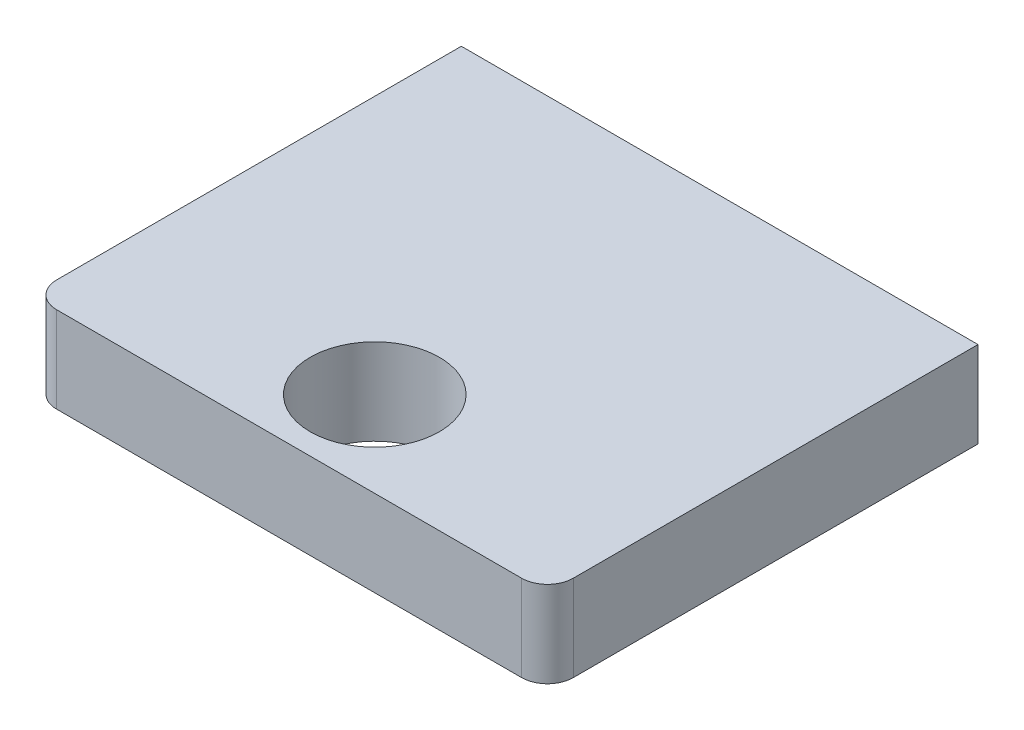
from build123d import *

# Parameters (mm, degrees)
SKETCH_1_W          = 60
SKETCH_1_H          = 50
EXTRUDE_1_DEPTH     = 10
SKETCH_2_R          = 4
CUT_EXTRUDE_1_DEPTH = 0.5
FILLET_1_R          = 3
SKETCH_3_R          = 7.5
CUT_EXTRUDE_2_DEPTH = 41.311288741


with BuildPart() as part:
    # 草图1 → 凸台-拉伸1 (new body)
    with BuildSketch(Plane(origin=(0, 0, 0), x_dir=(1, 0, 0), z_dir=(0, 1, 0))):
        Rectangle(SKETCH_1_W, SKETCH_1_H)
    extrude(amount=EXTRUDE_1_DEPTH)

    # 草图2 → 切除-拉伸1 (cut)
    with BuildSketch(Plane.XZ):
        with Locations(Location((-18, 16.9, 0), (0, 0, 270))):
            Circle(SKETCH_2_R)
        with Locations(Location((18, 16.9, 0), (0, 0, 270))):
            Circle(SKETCH_2_R)
    extrude(amount=-CUT_EXTRUDE_1_DEPTH, mode=Mode.SUBTRACT)

    # 圆角1
    fillet_1_edges = [part.edges().sort_by_distance(p)[0] for p in [
        (30, 5, 25),
        (-30, 5, 25),
    ]]
    fillet(fillet_1_edges, radius=FILLET_1_R)

    # 草图3 → 切除-拉伸2 (cut, through all)
    with BuildSketch(Plane(origin=(0, 10, 0), x_dir=(1, 0, 0), z_dir=(0, 1, 0))):
        with Locations(Location((0, -15.052922201, 0), (0, 0, 270))):
            Circle(SKETCH_3_R)
    extrude(amount=-CUT_EXTRUDE_2_DEPTH, mode=Mode.SUBTRACT)


solid = part.part
